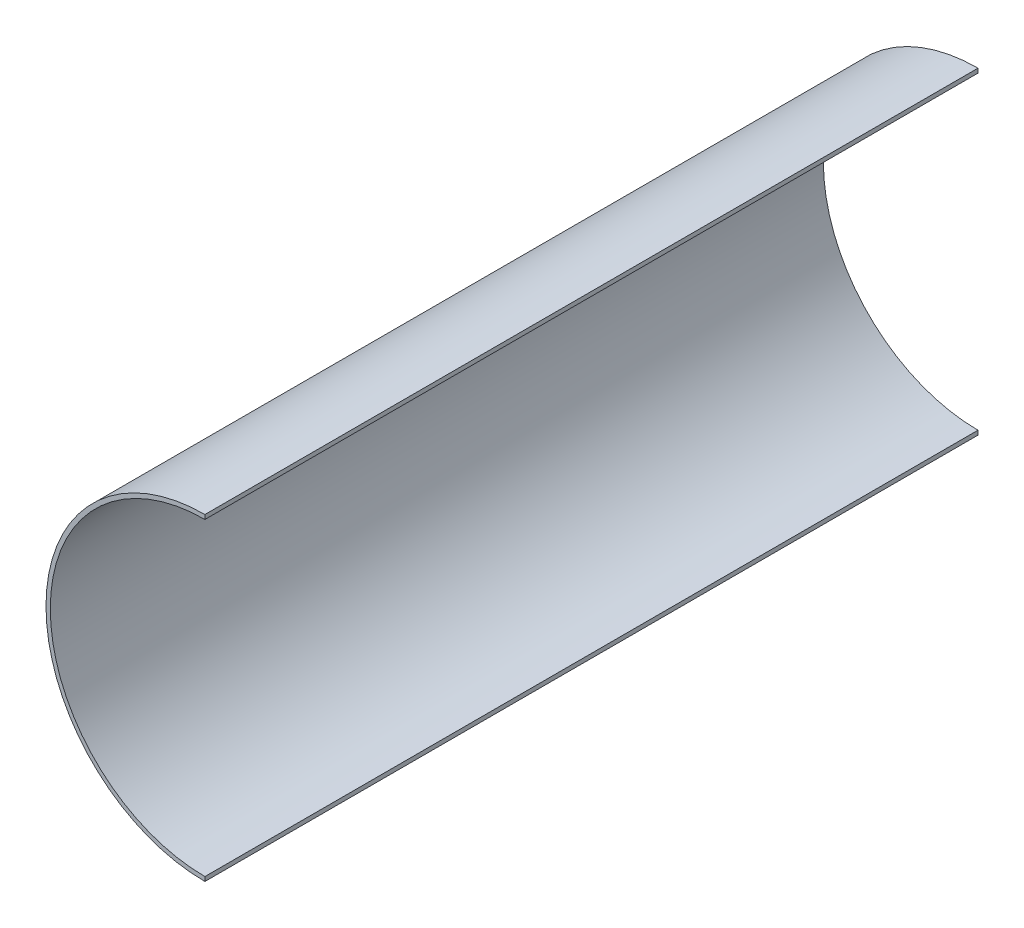
from build123d import *

# Parameters (mm, degrees)
SKETCH_1_R          = 18.5
SKETCH_1_R_2        = 18
EXTRUDE_1_DEPTH     = 90
SKETCH_4_W          = 20.552277559
SKETCH_4_H          = 41.870478505
CUT_EXTRUDE_1_DEPTH = 90


with BuildPart() as part:
    # 草图1 → 凸台-拉伸1 (new body)
    with BuildSketch(Plane.XY):
        with Locations(Location((0, 0, 0), (0, 0, 180))):
            Circle(SKETCH_1_R)
        with Locations(Location((0, 0, 0), (0, 0, 180))):
            Circle(SKETCH_1_R_2, mode=Mode.SUBTRACT)
    extrude(amount=EXTRUDE_1_DEPTH)

    # 草图4 → 切除-拉伸1 (cut)
    with BuildSketch(Plane(origin=(0, 0, 0), x_dir=(-1, 0, 0), z_dir=(0, 0, -1))):
        with Locations((-10.27613878, -0.506028893)):
            Rectangle(SKETCH_4_W, SKETCH_4_H)
    extrude(amount=-CUT_EXTRUDE_1_DEPTH, mode=Mode.SUBTRACT)


solid = part.part
